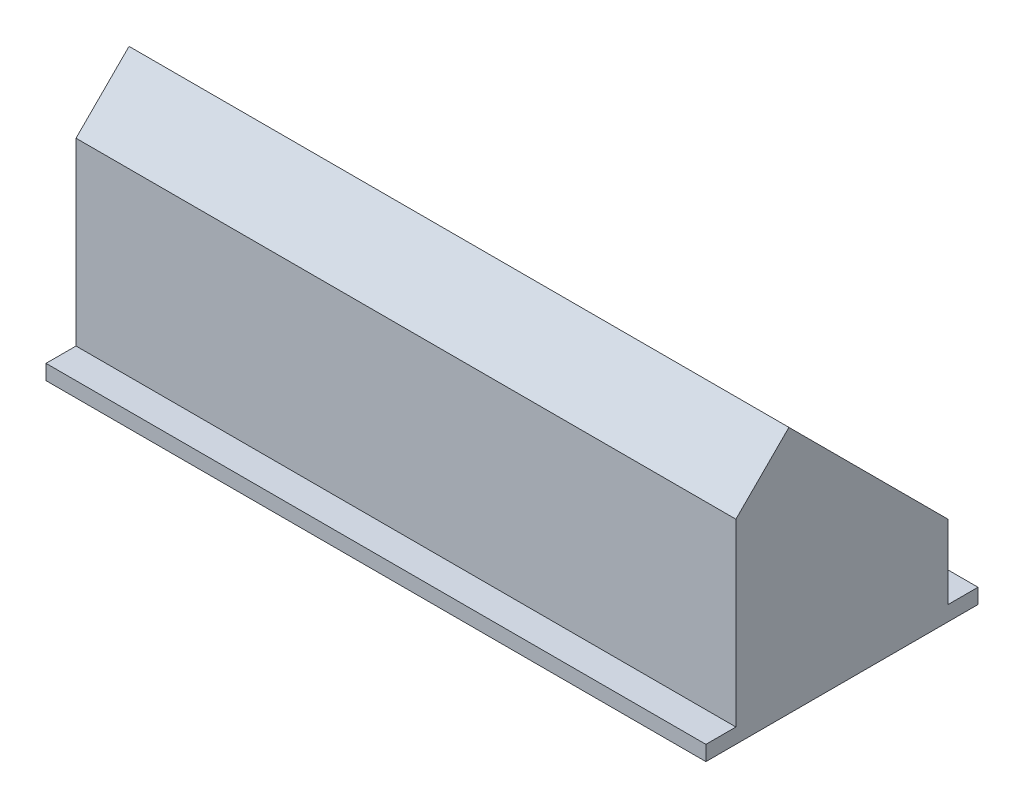
from build123d import *

# Parameters (mm, degrees)
BOSS_EXTRUDE1_DEPTH = 110
SHELL1_T            = -2
SKETCH3_W           = 216
SKETCH3_H           = 46
CUT_EXTRUDE1_DEPTH  = 10
BOSS_EXTRUDE2_REACH = 232.002
SKETCH6_R           = 1.5
CUT_EXTRUDE2_DEPTH  = 5


with BuildPart() as part:
    # Sketch2 → Boss-Extrude1 (new, symmetric)
    with BuildSketch(Plane(origin=(0, 0, 0), x_dir=(0, 0, -1), z_dir=(1, 0, 0))):
        Polygon((25, -30), (25, -5.355339059), (-28.033008589, 47.67766953), (-45.710678119, 30), (-45.710678119, -30), (-55.710678119, -30), (-55.710678119, -35), (-45.710678119, -35), (25, -35), (35, -35), (35, -30), align=None)
    extrude(amount=BOSS_EXTRUDE1_DEPTH, both=True)

    # Shell1
    shell1_openings = [part.faces().sort_by_distance(p)[0] for p in [
        (0, 21.161165235, 1.516504294),
    ]]
    offset(amount=SHELL1_T, openings=shell1_openings, kind=Kind.INTERSECTION)

    # Sketch3 → Cut-Extrude1 (cut)
    with BuildSketch(Plane(origin=(0, -33, 0), x_dir=(1, 0, 0), z_dir=(0, 1, 0))):
        Rectangle(SKETCH3_W, SKETCH3_H)
    extrude(amount=-CUT_EXTRUDE1_DEPTH, mode=Mode.SUBTRACT)

    # Sketch5 → Boss-Extrude2 (add, up to next)
    with BuildSketch(Plane(origin=(-108, 0, 0), x_dir=(0, 0, -1), z_dir=(1, 0, 0)), mode=Mode.PRIVATE) as boss_extrude2_sk1:
        Polygon((-36.441125497, 36.441125497), (23, -23), (23, -4.898066402), (17.484567107, -10.413499295), (-32.905591591, 39.976659403), align=None)
    boss_extrude2_tool1 = extrude(boss_extrude2_sk1.sketch, amount=BOSS_EXTRUDE2_REACH, mode=Mode.PRIVATE) - part.part
    add(boss_extrude2_tool1.solids().sort_by_distance((-108, 7.973571, 3.970996))[0])

    # Sketch6 → Cut-Extrude2 (cut, symmetric)
    with BuildSketch(Plane(origin=(0, 3.535533906, -3.535533906), x_dir=(1, 0, 0), z_dir=(0, 0.7071067811865476, -0.7071067811865475))):
        Polygon((-98, 13.636038969), (-108, 13.636038969), (-108, -46.535533906), (-98, -46.535533906), (-98, -51.535533906), (-5, -51.535533906), (-5, -46.535533906), (5, -46.535533906), (5, -51.535533906), (98, -51.535533906), (98, -46.535533906), (108, -46.535533906), (108, 13.636038969), (98, 13.636038969), (98, 18.636038969), (5, 18.636038969), (5, 13.636038969), (-5, 13.636038969), (-5, 18.636038969), (-98, 18.636038969), align=None)
        with Locations(Location((0, 16.136038969, 0), (0, 0, 90))):
            Circle(SKETCH6_R)
        with Locations(Location((-102.5, 16.136038969, 0), (0, 0, 90))):
            Circle(SKETCH6_R)
        with Locations(Location((102.5, 16.136038969, 0), (0, 0, 90))):
            Circle(SKETCH6_R)
        with Locations(Location((102.5, -49.035533906, 0), (0, 0, 90))):
            Circle(SKETCH6_R)
        with Locations(Location((0, -49.035533906, 0), (0, 0, 90))):
            Circle(SKETCH6_R)
        with Locations(Location((-102.5, -49.035533906, 0), (0, 0, 90))):
            Circle(SKETCH6_R)
    extrude(amount=CUT_EXTRUDE2_DEPTH, both=True, mode=Mode.SUBTRACT)


solid = part.part
